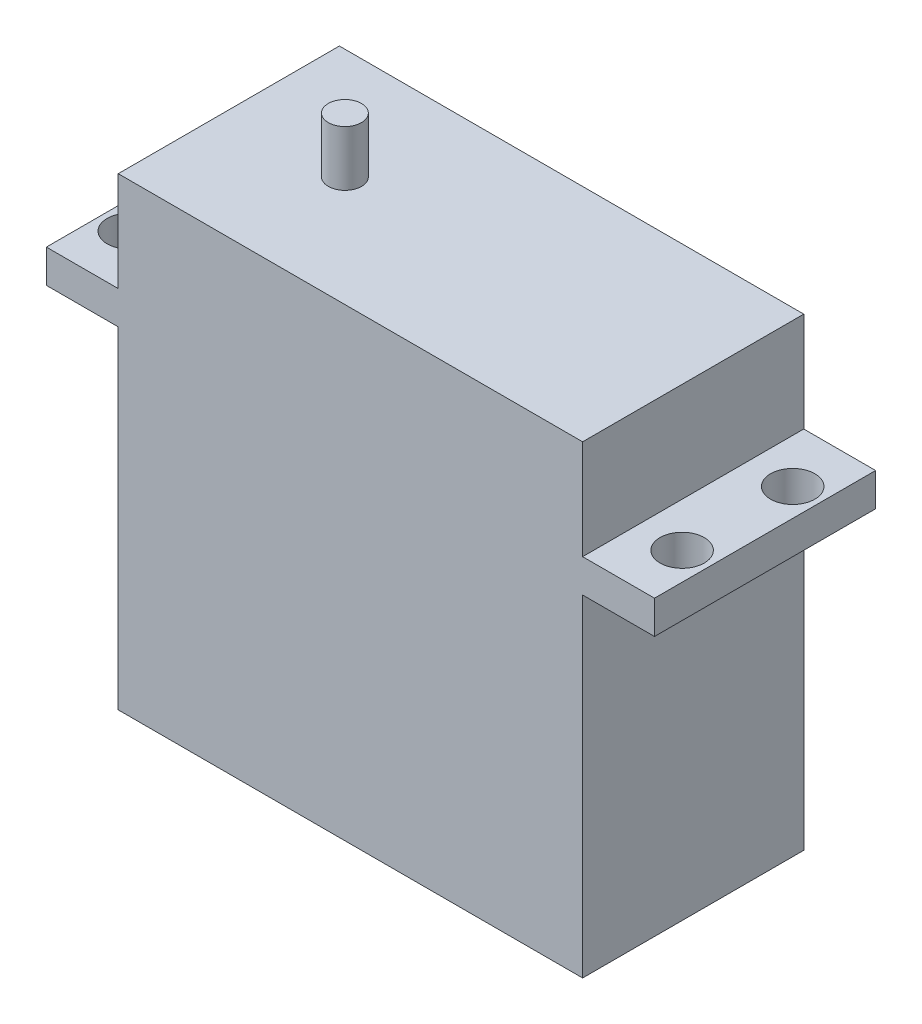
from build123d import *

# Parameters (mm, degrees)
SKETCH_1_W                = 55
SKETCH_1_H                = 42
EXTRUDE_1_DEPTH           = 20
SKETCH_2_W                = 6.5
SKETCH_2_H                = 9
CUT_EXTRUDE_1_DEPTH       = 68.203050526
SKETCH_3_W                = 6.5
SKETCH_3_H                = 30
CUT_EXTRUDE_2_DEPTH       = 68.203050526
SKETCH_4_W                = 6.5
SKETCH_4_H                = 30
CUT_EXTRUDE_3_DEPTH       = 68.203050526
SKETCH_5_W                = 6.5
SKETCH_5_H                = 9
CUT_EXTRUDE_4_DEPTH       = 68.203050526
SKETCH_6_W                = 3
SKETCH_6_H                = 5
HOLE_WIZARD_2_0_2_1_D     = 2
HOLE_WIZARD_2_0_2_1_DEPTH = 33
CUT_EXTRUDE_START         = -5
SKETCH_9_R                = 3
SKETCH_9_R_2              = 1.5
CUT_EXTRUDE_5_DEPTH       = 5
SKETCH_10_R               = 2
CUT_EXTRUDE_6_DEPTH       = 5


with BuildPart() as part:
    # 草图1 → 凸台-拉伸1 (new body)
    with BuildSketch(Plane.XY.offset(20)):
        with Locations((21, 21)):
            Rectangle(SKETCH_1_W, SKETCH_1_H)
    extrude(amount=-EXTRUDE_1_DEPTH)

    # 草图2 → 切除-拉伸1 (cut, through all)
    with BuildSketch(Plane(origin=(0, 0, 0), x_dir=(-1, 0, 0), z_dir=(0, 0, -1))):
        with Locations((3.25, 37.5)):
            Rectangle(SKETCH_2_W, SKETCH_2_H)
    extrude(amount=-CUT_EXTRUDE_1_DEPTH, mode=Mode.SUBTRACT)

    # 草图3 → 切除-拉伸2 (cut, through all)
    with BuildSketch(Plane(origin=(0, 0, 0), x_dir=(-1, 0, 0), z_dir=(0, 0, -1))):
        with Locations((3.25, 15)):
            Rectangle(SKETCH_3_W, SKETCH_3_H)
    extrude(amount=-CUT_EXTRUDE_2_DEPTH, mode=Mode.SUBTRACT)

    # 草图4 → 切除-拉伸3 (cut, through all)
    with BuildSketch(Plane(origin=(0, 0, 0), x_dir=(-1, 0, 0), z_dir=(0, 0, -1))):
        with Locations((-45.25, 15)):
            Rectangle(SKETCH_4_W, SKETCH_4_H)
    extrude(amount=-CUT_EXTRUDE_3_DEPTH, mode=Mode.SUBTRACT)

    # 草图5 → 切除-拉伸4 (cut, through all)
    with BuildSketch(Plane(origin=(0, 0, 0), x_dir=(-1, 0, 0), z_dir=(0, 0, -1))):
        with Locations((-45.25, 37.5)):
            Rectangle(SKETCH_5_W, SKETCH_5_H)
    extrude(amount=-CUT_EXTRUDE_4_DEPTH, mode=Mode.SUBTRACT)

    # 草图6 → 旋转1 (revolve)
    with BuildSketch(Plane(origin=(0, 0, 10.000000949), x_dir=(-1, 0, 0), z_dir=(0, 0, -1)), mode=Mode.PRIVATE) as revolve_1_sk:
        with Locations((-12, 44.5)):
            Rectangle(SKETCH_6_W, SKETCH_6_H)
    revolve(revolve_1_sk.sketch.rotate(Axis((10.5, 42, 10.000000949), (0, 1, 0)), 270), axis=Axis((10.5, 42, 10.000000949), (0, 1, 0)))

    # Ø2.0 (2) 直径孔1
    with Locations(Plane(origin=(0, 33, 0), x_dir=(1, 0, 0), z_dir=(0, 1, 0))):
        with Locations((46, -15.000000809), (-4, -5.000000809), (-4, -15.000000809), (46, -5.000000809)):
            Hole(HOLE_WIZARD_2_0_2_1_D / 2, depth=HOLE_WIZARD_2_0_2_1_DEPTH)

    # 草图9 → 切除-拉伸5 (cut)
    with BuildSketch(Plane(origin=(0, 47, 0), x_dir=(1, 0, 0), z_dir=(0, 1, 0)).offset(CUT_EXTRUDE_START)):
        with Locations((10.5, -10.000000949)):
            Circle(SKETCH_9_R)
        with Locations(Location((10.5, -10.000000949, 0), (0, 0, 270))):
            Circle(SKETCH_9_R_2, mode=Mode.SUBTRACT)
    extrude(amount=CUT_EXTRUDE_5_DEPTH, mode=Mode.SUBTRACT)

    # 草图10 → 切除-拉伸6 (cut)
    with BuildSketch(Plane(origin=(0, 33, 0), x_dir=(1, 0, 0), z_dir=(0, 1, 0))):
        with Locations(Location((46, -15.000000809, 0), (0, 0, 270))):
            Circle(SKETCH_10_R)
        with Locations(Location((46, -5.000000809, 0), (0, 0, 270))):
            Circle(SKETCH_10_R)
        with Locations(Location((-4, -5.000000809, 0), (0, 0, 270))):
            Circle(SKETCH_10_R)
        with Locations(Location((-4, -15.000000809, 0), (0, 0, 270))):
            Circle(SKETCH_10_R)
    extrude(amount=-CUT_EXTRUDE_6_DEPTH, mode=Mode.SUBTRACT)


solid = part.part
